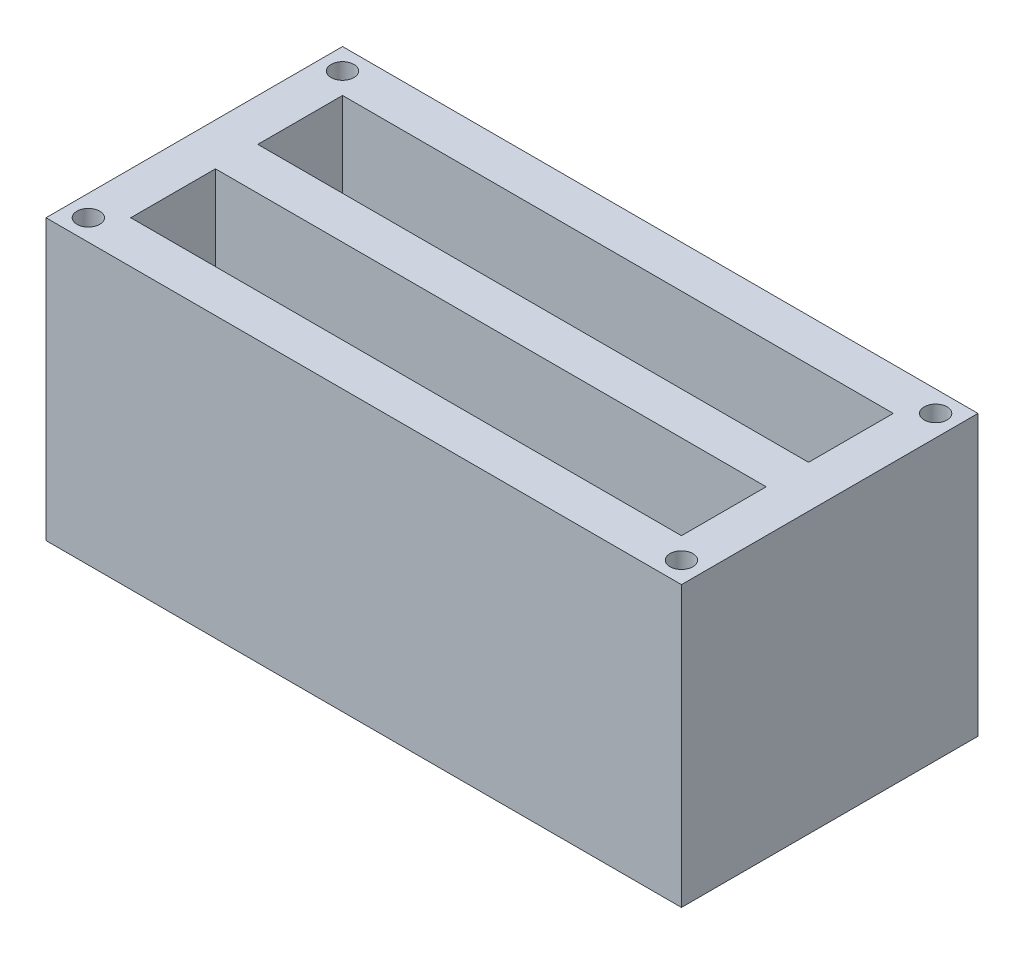
from build123d import *

# Parameters (mm, degrees)
SKETCH1_W           = 75
SKETCH1_H           = 35
BOSS_EXTRUDE1_DEPTH = 3
SKETCH2_W           = 75
SKETCH2_H           = 35
SKETCH2_W_2         = 65
SKETCH2_H_2         = 10
BOSS_EXTRUDE2_DEPTH = 30
CUT_EXTRUDE1_DEPTH  = 90.101066211
SKETCH4_R           = 1.35
CUT_EXTRUDE2_DEPTH  = 15
SKETCH5_R           = 1.35
CUT_EXTRUDE3_DEPTH  = 15


with BuildPart() as part:
    # Sketch1 → Boss-Extrude1 (new body)
    with BuildSketch(Plane(origin=(0, 0, 0), x_dir=(1, 0, 0), z_dir=(0, 1, 0))):
        with Locations((37.5, 17.5)):
            Rectangle(SKETCH1_W, SKETCH1_H)
    extrude(amount=BOSS_EXTRUDE1_DEPTH)

    # Sketch2 → Boss-Extrude2 (add)
    with BuildSketch(Plane(origin=(0, 3, 0), x_dir=(1, 0, 0), z_dir=(0, 1, 0))):
        with Locations((37.5, 17.5)):
            Rectangle(SKETCH2_W, SKETCH2_H)
        with Locations((37.5, 25)):
            Rectangle(SKETCH2_W_2, SKETCH2_H_2, mode=Mode.SUBTRACT)
        with Locations((37.5, 10)):
            Rectangle(SKETCH2_W_2, SKETCH2_H_2, mode=Mode.SUBTRACT)
    extrude(amount=BOSS_EXTRUDE2_DEPTH)

    # Sketch3 → Cut-Extrude1 (cut, through all)
    # profile 1 of 12: a face of its own
    with BuildSketch(Plane.XZ):
        Polygon((7.141025641, -6), (11.038461538, -6), (11.038461538, -7.435897436), (8.576923077, -7.435897436), (8.576923077, -8.974358974), (11.038461538, -8.974358974), (11.038461538, -10.41025641), (8.576923077, -10.41025641), (8.576923077, -14), (7.141025641, -14), align=None)
    # profile 2 of 12: a face of its own
    with BuildSketch(Plane.XZ):
        with BuildLine():
            add(Edge.make_bspline(
                [(16.233974359, -5.794871795), (16.373064163, -5.798473079), (16.647658941, -5.80558283), (17.051488767, -5.864848149), (17.440653473, -5.961412491), (17.814977079, -6.09564391), (18.173522321, -6.271178076), (18.517553909, -6.48303848), (18.845839539, -6.73522386), (19.155015201, -7.021851147), (19.440749275, -7.333545807), (19.688338016, -7.669140523), (19.899472611, -8.019939698), (20.074461529, -8.386883311), (20.207748161, -8.77251262), (20.301280903, -9.174861426), (20.361371056, -9.593815263), (20.368282348, -9.879065723), (20.371794872, -10.024038462)],
                knots=[0, 0, 0, 0, 1.014329547, 2.002516266, 2.970391464, 3.935626869, 4.897733899, 5.877609409, 6.878433252, 7.912639331, 8.949961323, 9.958554974, 10.949718813, 11.932905612, 12.9188844, 13.919928257, 14.942845884, 16, 16, 16, 16], degree=3))
            add(Edge.make_bspline(
                [(20.371794872, -10.024038462), (20.368054186, -10.167377692), (20.360683045, -10.449832246), (20.303734046, -10.864925258), (20.208626201, -11.26296407), (20.077600215, -11.64484965), (19.905784935, -12.008732276), (19.698767694, -12.356935287), (19.4510857, -12.686227277), (19.17177289, -12.996431535), (18.864273725, -13.278008461), (18.538583295, -13.526147641), (18.196205437, -13.736411418), (17.837641282, -13.908703481), (17.462121907, -14.042413006), (17.070574891, -14.136754792), (16.663024462, -14.1940882), (16.385870407, -14.201411194), (16.245192308, -14.205128205)],
                knots=[0, 0, 0, 0, 1.051557043, 2.072126891, 3.067553643, 4.050577992, 5.02905126, 6.015227836, 7.017913613, 8.04756643, 9.074058332, 10.072836633, 11.047628519, 12.017157415, 12.98668631, 13.966869689, 14.968021931, 16, 16, 16, 16], degree=3))
            add(Edge.make_bspline(
                [(16.245192308, -14.205128205), (16.098059884, -14.201793863), (15.808964783, -14.195242335), (15.385872809, -14.132940303), (14.980514139, -14.039091678), (14.596294021, -13.899027639), (14.229299499, -13.723935814), (13.882226992, -13.508299734), (13.555193138, -13.252475754), (13.250073856, -12.963015621), (12.973635048, -12.646282748), (12.729623577, -12.311682554), (12.523794488, -11.961771093), (12.35614025, -11.596384596), (12.223968384, -11.217793854), (12.130736149, -10.823693138), (12.075661644, -10.415027645), (12.067990085, -10.137453873), (12.064102564, -9.996794872)],
                knots=[0, 0, 0, 0, 1.067978421, 2.098431617, 3.099715153, 4.085208694, 5.062210972, 6.048429807, 7.046490867, 8.072918869, 9.098532598, 10.095778865, 11.076610158, 12.041847152, 13.011192615, 13.984257998, 14.978533688, 16, 16, 16, 16], degree=3))
            add(Edge.make_bspline(
                [(12.064102564, -9.996794872), (12.065322692, -9.902166859), (12.067747498, -9.714109042), (12.096956845, -9.435416956), (12.139009906, -9.162164565), (12.201204388, -8.895441331), (12.276754787, -8.633365645), (12.374641001, -8.378376973), (12.486062003, -8.127751334), (12.616246954, -7.884448931), (12.761000031, -7.650708349), (12.918938525, -7.427632184), (13.090459572, -7.217917752), (13.275010645, -7.020186897), (13.473227731, -6.835739318), (13.682503491, -6.661963902), (13.906896654, -6.503476743), (14.141495959, -6.356407268), (14.384978789, -6.223414892), (14.636353947, -6.11021576), (14.89044261, -6.011360885), (15.150639058, -5.933340247), (15.414154824, -5.869793254), (15.683805041, -5.827768536), (15.957153571, -5.798559999), (16.141481779, -5.796104114), (16.233974359, -5.794871795)],
                knots=[0, 0, 0, 0, 1.034744296, 2.056386356, 3.06226378, 4.057406941, 5.050368692, 6.043467995, 7.042652155, 8.049140477, 9.059438543, 10.048523776, 11.036952808, 12.020949711, 13.004946614, 13.997082645, 14.994316842, 16.007702937, 17.024872941, 18.026463647, 19.021641123, 20.005082605, 20.995858141, 21.984425357, 22.988620895, 24, 24, 24, 24], degree=3))
        make_face()
        with BuildLine():
            add(Edge.make_bspline(
                [(16.211538462, -7.230769231), (16.117931042, -7.233280928), (15.933187453, -7.238238013), (15.662202253, -7.276004299), (15.402046891, -7.336321349), (15.154163511, -7.423689859), (14.917477765, -7.534887799), (14.691570083, -7.669526628), (14.479568819, -7.832234407), (14.278647141, -8.014276079), (14.097147466, -8.217112338), (13.936786779, -8.434485886), (13.802590712, -8.666033711), (13.690200665, -8.909604791), (13.605595869, -9.167938016), (13.54533441, -9.439009835), (13.507251417, -9.723287318), (13.502451008, -9.917078908), (13.5, -10.016025641)],
                knots=[0, 0, 0, 0, 1.033739768, 2.040188636, 3.016340934, 3.979330865, 4.937572243, 5.900995986, 6.878200029, 7.884839167, 8.891893314, 9.879764717, 10.863503415, 11.843163062, 12.837761627, 13.859916423, 14.907309254, 16, 16, 16, 16], degree=3))
            add(Edge.make_bspline(
                [(13.5, -10.016025641), (13.503249662, -10.125680878), (13.509618462, -10.340586975), (13.554430113, -10.654086198), (13.631098388, -10.9501551), (13.741805885, -11.227345651), (13.879112227, -11.488735845), (14.049624911, -11.731121974), (14.250582439, -11.955955332), (14.405398491, -12.087222412), (14.483974359, -12.153846154)],
                knots=[0, 0, 0, 0, 1.078454662, 2.113592447, 3.107694534, 4.079536787, 5.043276885, 6.005368276, 6.987637804, 8, 8, 8, 8], degree=3))
            add(Edge.make_bspline(
                [(14.483974359, -12.153846154), (14.548342996, -12.203065215), (14.675630033, -12.300394425), (14.878807856, -12.425141773), (15.088041007, -12.532062695), (15.304908411, -12.618453535), (15.528952056, -12.686407118), (15.760141219, -12.733993894), (15.998148323, -12.763858712), (16.159099881, -12.767428123), (16.240384615, -12.769230769)],
                knots=[0, 0, 0, 0, 1.023928204, 2.024787132, 3.009472467, 3.9914905, 4.972207045, 5.96565515, 6.972602802, 8, 8, 8, 8], degree=3))
            add(Edge.make_bspline(
                [(16.240384615, -12.769230769), (16.332382454, -12.766697776), (16.513391093, -12.761714031), (16.779331758, -12.724412669), (17.034110991, -12.661285298), (17.279310485, -12.574683215), (17.514223194, -12.462089089), (17.737701035, -12.323274186), (17.950135825, -12.159942973), (18.150801532, -11.975510694), (18.334219474, -11.771875401), (18.494245522, -11.553342405), (18.632708353, -11.324726644), (18.742761247, -11.082792407), (18.830708587, -10.829823441), (18.890244769, -10.5646994), (18.928649477, -10.288513227), (18.933451238, -10.100558776), (18.935897436, -10.004807692)],
                knots=[0, 0, 0, 0, 1.026359118, 2.019393844, 2.989460624, 3.950973911, 4.916101784, 5.890408035, 6.881132271, 7.902007068, 8.92769091, 9.933912415, 10.920395702, 11.90457117, 12.894218921, 13.903490204, 14.931958862, 16, 16, 16, 16], degree=3))
            add(Edge.make_bspline(
                [(18.935897436, -10.004807692), (18.933366599, -9.909607203), (18.928385032, -9.72221956), (18.891018018, -9.44674346), (18.828290984, -9.182789864), (18.741428844, -8.929927709), (18.630510492, -8.687909096), (18.493348696, -8.457585105), (18.330424741, -8.239178403), (18.145488312, -8.034177348), (17.944196376, -7.845794511), (17.728089369, -7.682312453), (17.503214209, -7.540251742), (17.264411162, -7.428967117), (17.016565938, -7.340306893), (16.758166173, -7.275016231), (16.488233162, -7.238503323), (16.304592153, -7.233370241), (16.211538462, -7.230769231)],
                knots=[0, 0, 0, 0, 1.055025985, 2.07665775, 3.074803781, 4.057872707, 5.035505728, 6.020516407, 7.023567878, 8.050795229, 9.077271434, 10.074415901, 11.050397877, 12.019801805, 12.988065821, 13.964604439, 14.968634123, 16, 16, 16, 16], degree=3))
        make_face(mode=Mode.SUBTRACT)
    # profile 3 of 12: a face of its own
    with BuildSketch(Plane.XZ):
        Polygon((21.807692308, -6), (23.243589744, -6), (23.243589744, -12.564102564), (25.5, -12.564102564), (25.5, -14), (21.807692308, -14), align=None)
    # profile 4 of 12: a face of its own
    with BuildSketch(Plane.XZ):
        Polygon((26.730769231, -6), (28.166666667, -6), (28.166666667, -12.564102564), (30.423076923, -12.564102564), (30.423076923, -14), (26.730769231, -14), align=None)
    # profile 5 of 12: a face of its own
    with BuildSketch(Plane.XZ):
        with BuildLine():
            add(Edge.make_bspline(
                [(35.413461538, -5.794871795), (35.552551343, -5.798473079), (35.82714612, -5.80558283), (36.230975947, -5.864848149), (36.620140652, -5.961412491), (36.994464258, -6.09564391), (37.353009501, -6.271178076), (37.697041089, -6.48303848), (38.025326718, -6.73522386), (38.334502381, -7.021851147), (38.620236454, -7.333545807), (38.867825195, -7.669140523), (39.078959791, -8.019939698), (39.253948708, -8.386883311), (39.38723534, -8.77251262), (39.480768083, -9.174861426), (39.540858236, -9.593815263), (39.547769528, -9.879065723), (39.551282051, -10.024038462)],
                knots=[0, 0, 0, 0, 1.014329547, 2.002516266, 2.970391464, 3.935626869, 4.897733899, 5.877609409, 6.878433252, 7.912639331, 8.949961323, 9.958554974, 10.949718813, 11.932905612, 12.9188844, 13.919928257, 14.942845884, 16, 16, 16, 16], degree=3))
            add(Edge.make_bspline(
                [(39.551282051, -10.024038462), (39.547541366, -10.167377692), (39.540170225, -10.449832246), (39.483221226, -10.864925258), (39.38811338, -11.26296407), (39.257087394, -11.64484965), (39.085272114, -12.008732276), (38.878254873, -12.356935287), (38.63057288, -12.686227277), (38.351260069, -12.996431535), (38.043760905, -13.278008461), (37.718070475, -13.526147641), (37.375692617, -13.736411418), (37.017128462, -13.908703481), (36.641609087, -14.042413006), (36.25006207, -14.136754792), (35.842511642, -14.1940882), (35.565357586, -14.201411194), (35.424679487, -14.205128205)],
                knots=[0, 0, 0, 0, 1.051557043, 2.072126891, 3.067553643, 4.050577992, 5.02905126, 6.015227836, 7.017913613, 8.04756643, 9.074058332, 10.072836633, 11.047628519, 12.017157415, 12.98668631, 13.966869689, 14.968021931, 16, 16, 16, 16], degree=3))
            add(Edge.make_bspline(
                [(35.424679487, -14.205128205), (35.277547064, -14.201793863), (34.988451963, -14.195242335), (34.565359988, -14.132940303), (34.160001319, -14.039091678), (33.7757812, -13.899027639), (33.408786679, -13.723935814), (33.061714171, -13.508299734), (32.734680317, -13.252475754), (32.429561036, -12.963015621), (32.153122228, -12.646282748), (31.909110756, -12.311682554), (31.703281667, -11.961771093), (31.535627429, -11.596384596), (31.403455563, -11.217793854), (31.310223329, -10.823693138), (31.255148823, -10.415027645), (31.247477264, -10.137453873), (31.243589744, -9.996794872)],
                knots=[0, 0, 0, 0, 1.067978421, 2.098431617, 3.099715153, 4.085208694, 5.062210972, 6.048429807, 7.046490867, 8.072918869, 9.098532598, 10.095778865, 11.076610158, 12.041847152, 13.011192615, 13.984257998, 14.978533688, 16, 16, 16, 16], degree=3))
            add(Edge.make_bspline(
                [(31.243589744, -9.996794872), (31.244809872, -9.902166859), (31.247234678, -9.714109042), (31.276444024, -9.435416956), (31.318497085, -9.162164565), (31.380691567, -8.895441331), (31.456241966, -8.633365645), (31.55412818, -8.378376973), (31.665549183, -8.127751334), (31.795734133, -7.884448931), (31.94048721, -7.650708349), (32.098425705, -7.427632184), (32.269946752, -7.217917752), (32.454497824, -7.020186897), (32.652714911, -6.835739318), (32.86199067, -6.661963902), (33.086383833, -6.503476743), (33.320983138, -6.356407268), (33.564465968, -6.223414892), (33.815841127, -6.11021576), (34.069929789, -6.011360885), (34.330126238, -5.933340247), (34.593642004, -5.869793254), (34.86329222, -5.827768536), (35.136640751, -5.798559999), (35.320968959, -5.796104114), (35.413461538, -5.794871795)],
                knots=[0, 0, 0, 0, 1.034744296, 2.056386356, 3.06226378, 4.057406941, 5.050368692, 6.043467995, 7.042652155, 8.049140477, 9.059438543, 10.048523776, 11.036952808, 12.020949711, 13.004946614, 13.997082645, 14.994316842, 16.007702937, 17.024872941, 18.026463647, 19.021641123, 20.005082605, 20.995858141, 21.984425357, 22.988620895, 24, 24, 24, 24], degree=3))
        make_face()
        with BuildLine():
            add(Edge.make_bspline(
                [(35.391025641, -7.230769231), (35.297418221, -7.233280928), (35.112674632, -7.238238013), (34.841689432, -7.276004299), (34.58153407, -7.336321349), (34.33365069, -7.423689859), (34.096964945, -7.534887799), (33.871057263, -7.669526628), (33.659055998, -7.832234407), (33.45813432, -8.014276079), (33.276634646, -8.217112338), (33.116273958, -8.434485886), (32.982077891, -8.666033711), (32.869687845, -8.909604791), (32.785083049, -9.167938016), (32.724821589, -9.439009835), (32.686738596, -9.723287318), (32.681938188, -9.917078908), (32.679487179, -10.016025641)],
                knots=[0, 0, 0, 0, 1.033739768, 2.040188636, 3.016340934, 3.979330865, 4.937572243, 5.900995986, 6.878200029, 7.884839167, 8.891893314, 9.879764717, 10.863503415, 11.843163062, 12.837761627, 13.859916423, 14.907309254, 16, 16, 16, 16], degree=3))
            add(Edge.make_bspline(
                [(32.679487179, -10.016025641), (32.682736842, -10.125680878), (32.689105642, -10.340586975), (32.733917293, -10.654086198), (32.810585567, -10.9501551), (32.921293065, -11.227345651), (33.058599406, -11.488735845), (33.22911209, -11.731121974), (33.430069619, -11.955955332), (33.584885671, -12.087222412), (33.663461538, -12.153846154)],
                knots=[0, 0, 0, 0, 1.078454662, 2.113592447, 3.107694534, 4.079536787, 5.043276885, 6.005368276, 6.987637804, 8, 8, 8, 8], degree=3))
            add(Edge.make_bspline(
                [(33.663461538, -12.153846154), (33.727830175, -12.203065215), (33.855117212, -12.300394425), (34.058295036, -12.425141773), (34.267528186, -12.532062695), (34.48439559, -12.618453535), (34.708439235, -12.686407118), (34.939628398, -12.733993894), (35.177635503, -12.763858712), (35.338587061, -12.767428123), (35.419871795, -12.769230769)],
                knots=[0, 0, 0, 0, 1.023928204, 2.024787132, 3.009472467, 3.9914905, 4.972207045, 5.96565515, 6.972602802, 8, 8, 8, 8], degree=3))
            add(Edge.make_bspline(
                [(35.419871795, -12.769230769), (35.511869633, -12.766697776), (35.692878273, -12.761714031), (35.958818937, -12.724412669), (36.213598171, -12.661285298), (36.458797665, -12.574683215), (36.693710373, -12.462089089), (36.917188214, -12.323274186), (37.129623005, -12.159942973), (37.330288712, -11.975510694), (37.513706653, -11.771875401), (37.673732701, -11.553342405), (37.812195533, -11.324726644), (37.922248426, -11.082792407), (38.010195767, -10.829823441), (38.069731948, -10.5646994), (38.108136656, -10.288513227), (38.112938417, -10.100558776), (38.115384615, -10.004807692)],
                knots=[0, 0, 0, 0, 1.026359118, 2.019393844, 2.989460624, 3.950973911, 4.916101784, 5.890408035, 6.881132271, 7.902007068, 8.92769091, 9.933912415, 10.920395702, 11.90457117, 12.894218921, 13.903490204, 14.931958862, 16, 16, 16, 16], degree=3))
            add(Edge.make_bspline(
                [(38.115384615, -10.004807692), (38.112853778, -9.909607203), (38.107872212, -9.72221956), (38.070505198, -9.44674346), (38.007778164, -9.182789864), (37.920916024, -8.929927709), (37.809997671, -8.687909096), (37.672835876, -8.457585105), (37.509911921, -8.239178403), (37.324975492, -8.034177348), (37.123683555, -7.845794511), (36.907576549, -7.682312453), (36.682701388, -7.540251742), (36.443898341, -7.428967117), (36.196053117, -7.340306893), (35.937653352, -7.275016231), (35.667720341, -7.238503323), (35.484079332, -7.233370241), (35.391025641, -7.230769231)],
                knots=[0, 0, 0, 0, 1.055025985, 2.07665775, 3.074803781, 4.057872707, 5.035505728, 6.020516407, 7.023567878, 8.050795229, 9.077271434, 10.074415901, 11.050397877, 12.019801805, 12.988065821, 13.964604439, 14.968634123, 16, 16, 16, 16], degree=3))
        make_face(mode=Mode.SUBTRACT)
    # profile 6 of 12: a face of its own
    with BuildSketch(Plane.XZ):
        Polygon((40.217948718, -6), (41.700320513, -6), (42.884615385, -11.107371795), (44.241987179, -6), (45.637820513, -6), (46.987179487, -11.107371795), (48.168269231, -6), (49.653846154, -6), (47.802884615, -14), (46.302884615, -14), (44.935897436, -8.828525641), (43.560897436, -14), (42.072115385, -14), align=None)
    # profile 7 of 12: a face of its own
    with BuildSketch(Plane.XZ):
        Polygon((54.645833333, -6), (56.136217949, -6), (57.961538462, -11.580128205), (59.799679487, -6), (61.275641026, -6), (62.628205128, -14), (61.174679487, -14), (60.320512821, -8.947115385), (58.657051282, -14), (57.256410256, -14), (55.602564103, -8.947115385), (54.75, -14), (53.294871795, -14), align=None)
    # profile 8 of 12: a face of its own
    with BuildSketch(Plane.XZ):
        Polygon((63.961538462, -6), (68.269230769, -6), (68.269230769, -7.435897436), (65.397435897, -7.435897436), (65.397435897, -8.974358974), (68.269230769, -8.974358974), (68.269230769, -10.41025641), (65.397435897, -10.41025641), (65.397435897, -12.564102564), (68.269230769, -12.564102564), (68.269230769, -14), (63.961538462, -14), align=None)
    # profile 9 of 12: a face of its own
    with BuildSketch(Plane.XZ):
        with BuildLine():
            Line((29.602564103, -22.068910256), (28.528846154, -23.051282051))
            add(Edge.make_bspline(
                [(28.528846154, -23.051282051), (28.482852681, -22.986403476), (28.394551627, -22.86184566), (28.251424828, -22.695059807), (28.108944321, -22.552779064), (27.965790109, -22.435597811), (27.820693328, -22.344228013), (27.673905845, -22.279537187), (27.526259839, -22.238412615), (27.427064515, -22.233291616), (27.378205128, -22.230769231)],
                knots=[0, 0, 0, 0, 1.299362458, 2.494594718, 3.587462134, 4.587049575, 5.512617175, 6.380583204, 7.202344345, 8, 8, 8, 8], degree=3))
            add(Edge.make_bspline(
                [(27.378205128, -22.230769231), (27.332630494, -22.23236753), (27.244637848, -22.235453426), (27.119197804, -22.266127), (27.007830347, -22.319065086), (26.910644166, -22.388286086), (26.833658372, -22.471681343), (26.772191185, -22.559141525), (26.737579994, -22.655677786), (26.73302448, -22.721982785), (26.730769231, -22.754807692)],
                knots=[0, 0, 0, 0, 1.185010067, 2.2879431, 3.333075148, 4.379039566, 5.372662701, 6.27520591, 7.14612461, 8, 8, 8, 8], degree=3))
            add(Edge.make_bspline(
                [(26.730769231, -22.754807692), (26.732182481, -22.78810595), (26.735028572, -22.855164012), (26.762517929, -22.953445954), (26.80395224, -23.049478853), (26.843544415, -23.107938648), (26.863782051, -23.137820513)],
                knots=[0, 0, 0, 0, 0.967525499, 1.948461899, 2.951351359, 4, 4, 4, 4], degree=3))
            add(Edge.make_bspline(
                [(26.863782051, -23.137820513), (26.882180252, -23.161047374), (26.924530479, -23.21451254), (27.005283688, -23.29919303), (27.10669276, -23.402934042), (27.232660128, -23.522168226), (27.377956541, -23.661183712), (27.549316675, -23.814515746), (27.741808038, -23.986912844), (27.878626439, -24.10696394), (27.950320513, -24.169871795)],
                knots=[0, 0, 0, 0, 0.473873513, 1.090794244, 1.870441696, 2.795289791, 3.865433203, 5.087734844, 6.473946851, 8, 8, 8, 8], degree=3))
            add(Edge.make_bspline(
                [(27.950320513, -24.169871795), (28.017615714, -24.228112397), (28.145328024, -24.33864096), (28.327037281, -24.495518509), (28.486729454, -24.636657414), (28.626730895, -24.759939483), (28.744919317, -24.866658227), (28.841791585, -24.95732376), (28.918530831, -25.030170991), (28.962152598, -25.074170763), (28.980769231, -25.092948718)],
                knots=[0, 0, 0, 0, 1.543621617, 2.929473131, 4.163658386, 5.240097082, 6.164993805, 6.925417477, 7.541396219, 8, 8, 8, 8], degree=3))
            add(Edge.make_bspline(
                [(28.980769231, -25.092948718), (29.051396852, -25.169382931), (29.187167945, -25.31631633), (29.363622502, -25.54401689), (29.50885031, -25.766299066), (29.621201297, -25.987345456), (29.706053281, -26.210345322), (29.765875053, -26.440767722), (29.801702711, -26.681020426), (29.805680418, -26.844963567), (29.807692308, -26.927884615)],
                knots=[0, 0, 0, 0, 1.206664779, 2.319633467, 3.337109185, 4.282041471, 5.190008762, 6.099243693, 7.03861361, 8, 8, 8, 8], degree=3))
            add(Edge.make_bspline(
                [(29.807692308, -26.927884615), (29.806260296, -27.008681007), (29.803450635, -27.167206535), (29.769037681, -27.399185032), (29.719966827, -27.621198521), (29.644094679, -27.830831183), (29.551622154, -28.031524072), (29.435694489, -28.220151033), (29.299553342, -28.398621047), (29.143514684, -28.563743745), (28.970917399, -28.713581147), (28.785790409, -28.846969942), (28.586323446, -28.957099383), (28.374220727, -29.047783123), (28.149595784, -29.117628951), (27.912716214, -29.169251528), (27.663219694, -29.200234585), (27.492610378, -29.203473496), (27.405448718, -29.205128205)],
                knots=[0, 0, 0, 0, 1.043214005, 2.046824704, 3.02475056, 3.976699089, 4.921714032, 5.875962561, 6.831408892, 7.817874052, 8.806269674, 9.781291748, 10.760897367, 11.74438705, 12.757449933, 13.795994037, 14.874007457, 16, 16, 16, 16], degree=3))
            add(Edge.make_bspline(
                [(27.405448718, -29.205128205), (27.337027557, -29.203914368), (27.20151442, -29.201510275), (27.001788542, -29.181882854), (26.808930629, -29.150206284), (26.623157919, -29.104804298), (26.443633472, -29.047273824), (26.270349916, -28.977002553), (26.104503483, -28.892901307), (25.944839303, -28.796699543), (25.79213354, -28.684996623), (25.644455288, -28.560076277), (25.50327143, -28.420017173), (25.367903887, -28.265150546), (25.239218779, -28.095037852), (25.113003781, -27.912048223), (24.994868266, -27.712785622), (24.921890704, -27.573001295), (24.884615385, -27.501602564)],
                knots=[0, 0, 0, 0, 1.016823716, 2.013894106, 2.979844003, 3.91962641, 4.853723003, 5.779685073, 6.695824784, 7.614987388, 8.547259901, 9.504950863, 10.487499108, 11.500346958, 12.559593716, 13.656357062, 14.802919212, 16, 16, 16, 16], degree=3))
            Line((24.884615385, -27.501602564), (26.147435897, -26.743589744))
            add(Edge.make_bspline(
                [(26.147435897, -26.743589744), (26.19406175, -26.824636632), (26.283447495, -26.980010445), (26.434919996, -27.188774854), (26.590095841, -27.367547013), (26.752562555, -27.513167114), (26.920344605, -27.627582284), (27.094252416, -27.709351302), (27.274408174, -27.759966231), (27.397122091, -27.766147483), (27.458333333, -27.769230769)],
                knots=[0, 0, 0, 0, 1.283663364, 2.460892379, 3.537111102, 4.529833553, 5.449777664, 6.316464042, 7.160231139, 8, 8, 8, 8], degree=3))
            add(Edge.make_bspline(
                [(27.458333333, -27.769230769), (27.52059393, -27.766712791), (27.641388555, -27.761827546), (27.813807424, -27.716704009), (27.971887572, -27.645856747), (28.108530884, -27.544767473), (28.224231826, -27.428095087), (28.309625762, -27.298291723), (28.363270809, -27.157847616), (28.368942391, -27.060285901), (28.371794872, -27.011217949)],
                knots=[0, 0, 0, 0, 1.13588714, 2.203786484, 3.234766741, 4.283437687, 5.291419208, 6.222934724, 7.106237994, 8, 8, 8, 8], degree=3))
            add(Edge.make_bspline(
                [(28.371794872, -27.011217949), (28.369160723, -26.965568204), (28.363809701, -26.872835118), (28.324395721, -26.734955931), (28.26277965, -26.597139448), (28.189883493, -26.48409864), (28.115702526, -26.389452636), (28.044768789, -26.307446155), (27.958390262, -26.21684335), (27.856785962, -26.11753025), (27.741298348, -26.008632576), (27.611830136, -25.890160992), (27.466898778, -25.763159091), (27.364461008, -25.676646651), (27.310897436, -25.631410256)],
                knots=[0, 0, 0, 0, 0.916159276, 1.861089862, 2.860218735, 3.940849679, 4.552606315, 5.27541173, 6.11797699, 7.06649574, 8.129236253, 9.306560635, 10.591630461, 12, 12, 12, 12], degree=3))
            add(Edge.make_bspline(
                [(27.310897436, -25.631410256), (27.209070953, -25.545255287), (27.013635111, -25.379897824), (26.737459471, -25.135670057), (26.488600491, -24.90741683), (26.269207584, -24.692316435), (26.076485346, -24.494341277), (25.911738975, -24.311883326), (25.776778284, -24.143535169), (25.634761259, -23.944138043), (25.49981669, -23.701158944), (25.383186289, -23.40882692), (25.307521407, -23.116531989), (25.299044209, -22.920301271), (25.294871795, -22.823717949)],
                knots=[0, 0, 0, 0, 1.345494975, 2.582412109, 3.71882943, 4.751509156, 5.681369928, 6.505683931, 7.230279997, 7.856715994, 8.973648664, 10.023341002, 11.027102913, 12, 12, 12, 12], degree=3))
            add(Edge.make_bspline(
                [(25.294871795, -22.823717949), (25.296607097, -22.75522624), (25.300025827, -22.620290218), (25.330521433, -22.421886457), (25.376098277, -22.230443499), (25.442288939, -22.046659814), (25.528196426, -21.870765598), (25.632527732, -21.701899777), (25.756902925, -21.541616551), (25.897065371, -21.390022179), (26.051488501, -21.251482174), (26.21650924, -21.129206738), (26.391193555, -21.025931126), (26.574472817, -20.940256507), (26.767482731, -20.874678029), (26.968801402, -20.828192735), (27.178717584, -20.800544765), (27.32149804, -20.796786344), (27.394230769, -20.794871795)],
                knots=[0, 0, 0, 0, 1.010766082, 1.991317756, 2.957454644, 3.913069143, 4.869106762, 5.843196583, 6.838735724, 7.860187025, 8.887984031, 9.89767229, 10.887916223, 11.879572884, 12.879850636, 13.892031539, 14.926195476, 16, 16, 16, 16], degree=3))
            add(Edge.make_bspline(
                [(27.394230769, -20.794871795), (27.488488787, -20.798319954), (27.676260782, -20.805189054), (27.953887092, -20.858903168), (28.225060865, -20.943374271), (28.443577772, -21.045279364), (28.617447597, -21.143994875), (28.750702576, -21.234879682), (28.88629669, -21.338993115), (29.025323421, -21.45666326), (29.165199437, -21.590107178), (29.309902083, -21.736148132), (29.457459607, -21.896048258), (29.553348602, -22.010280166), (29.602564103, -22.068910256)],
                knots=[0, 0, 0, 0, 1.282922637, 2.555718331, 3.837320111, 5.142675274, 5.830281639, 6.55870424, 7.337177975, 8.157850921, 9.037902056, 9.96903443, 10.957596896, 12, 12, 12, 12], degree=3))
        make_face()
    # profile 10 of 12: a face of its own
    with BuildSketch(Plane.XZ):
        Polygon((30.423076923, -21), (34.730769231, -21), (34.730769231, -22.435897436), (33.294871795, -22.435897436), (33.294871795, -29), (31.858974359, -29), (31.858974359, -22.435897436), (30.423076923, -22.435897436), align=None)
    # profile 11 of 12: a face of its own
    with BuildSketch(Plane.XZ):
        with BuildLine():
            add(Edge.make_bspline(
                [(39.618589744, -20.794871795), (39.757679548, -20.798473079), (40.032274325, -20.80558283), (40.436104152, -20.864848149), (40.825268858, -20.961412491), (41.199592463, -21.09564391), (41.558137706, -21.271178076), (41.902169294, -21.48303848), (42.230454923, -21.73522386), (42.539630586, -22.021851147), (42.825364659, -22.333545807), (43.0729534, -22.669140523), (43.284087996, -23.019939698), (43.459076914, -23.386883311), (43.592363545, -23.77251262), (43.685896288, -24.174861426), (43.745986441, -24.593815263), (43.752897733, -24.879065723), (43.756410256, -25.024038462)],
                knots=[0, 0, 0, 0, 1.014329547, 2.002516266, 2.970391464, 3.935626869, 4.897733899, 5.877609409, 6.878433252, 7.912639331, 8.949961323, 9.958554974, 10.949718813, 11.932905612, 12.9188844, 13.919928257, 14.942845884, 16, 16, 16, 16], degree=3))
            add(Edge.make_bspline(
                [(43.756410256, -25.024038462), (43.752669571, -25.167377692), (43.74529843, -25.449832246), (43.688349431, -25.864925258), (43.593241585, -26.26296407), (43.462215599, -26.64484965), (43.290400319, -27.008732276), (43.083383078, -27.356935287), (42.835701085, -27.686227277), (42.556388275, -27.996431535), (42.24888911, -28.278008461), (41.92319868, -28.526147641), (41.580820822, -28.736411418), (41.222256667, -28.908703481), (40.846737292, -29.042413006), (40.455190276, -29.136754792), (40.047639847, -29.1940882), (39.770485791, -29.201411194), (39.629807692, -29.205128205)],
                knots=[0, 0, 0, 0, 1.051557043, 2.072126891, 3.067553643, 4.050577992, 5.02905126, 6.015227836, 7.017913613, 8.04756643, 9.074058332, 10.072836633, 11.047628519, 12.017157415, 12.98668631, 13.966869689, 14.968021931, 16, 16, 16, 16], degree=3))
            add(Edge.make_bspline(
                [(39.629807692, -29.205128205), (39.482675269, -29.201793863), (39.193580168, -29.195242335), (38.770488194, -29.132940303), (38.365129524, -29.039091678), (37.980909405, -28.899027639), (37.613914884, -28.723935814), (37.266842377, -28.508299734), (36.939808522, -28.252475754), (36.634689241, -27.963015621), (36.358250433, -27.646282748), (36.114238961, -27.311682554), (35.908409872, -26.961771093), (35.740755634, -26.596384596), (35.608583768, -26.217793854), (35.515351534, -25.823693138), (35.460277028, -25.415027645), (35.452605469, -25.137453873), (35.448717949, -24.996794872)],
                knots=[0, 0, 0, 0, 1.067978421, 2.098431617, 3.099715153, 4.085208694, 5.062210972, 6.048429807, 7.046490867, 8.072918869, 9.098532598, 10.095778865, 11.076610158, 12.041847152, 13.011192615, 13.984257998, 14.978533688, 16, 16, 16, 16], degree=3))
            add(Edge.make_bspline(
                [(35.448717949, -24.996794872), (35.449938077, -24.902166859), (35.452362883, -24.714109042), (35.481572229, -24.435416956), (35.52362529, -24.162164565), (35.585819772, -23.895441331), (35.661370171, -23.633365645), (35.759256386, -23.378376973), (35.870677388, -23.127751334), (36.000862338, -22.884448931), (36.145615415, -22.650708349), (36.30355391, -22.427632184), (36.475074957, -22.217917752), (36.659626029, -22.020186897), (36.857843116, -21.835739318), (37.067118875, -21.661963902), (37.291512039, -21.503476743), (37.526111344, -21.356407268), (37.769594173, -21.223414892), (38.020969332, -21.11021576), (38.275057994, -21.011360885), (38.535254443, -20.933340247), (38.798770209, -20.869793254), (39.068420425, -20.827768536), (39.341768956, -20.798559999), (39.526097164, -20.796104114), (39.618589744, -20.794871795)],
                knots=[0, 0, 0, 0, 1.034744296, 2.056386356, 3.06226378, 4.057406941, 5.050368692, 6.043467995, 7.042652155, 8.049140477, 9.059438543, 10.048523776, 11.036952808, 12.020949711, 13.004946614, 13.997082645, 14.994316842, 16.007702937, 17.024872941, 18.026463647, 19.021641123, 20.005082605, 20.995858141, 21.984425357, 22.988620895, 24, 24, 24, 24], degree=3))
        make_face()
        with BuildLine():
            add(Edge.make_bspline(
                [(39.596153846, -22.230769231), (39.502546426, -22.233280928), (39.317802837, -22.238238013), (39.046817637, -22.276004299), (38.786662275, -22.336321349), (38.538778896, -22.423689859), (38.30209315, -22.534887799), (38.076185468, -22.669526628), (37.864184203, -22.832234407), (37.663262525, -23.014276079), (37.481762851, -23.217112338), (37.321402163, -23.434485886), (37.187206096, -23.666033711), (37.07481605, -23.909604791), (36.990211254, -24.167938016), (36.929949794, -24.439009835), (36.891866801, -24.723287318), (36.887066393, -24.917078908), (36.884615385, -25.016025641)],
                knots=[0, 0, 0, 0, 1.033739768, 2.040188636, 3.016340934, 3.979330865, 4.937572243, 5.900995986, 6.878200029, 7.884839167, 8.891893314, 9.879764717, 10.863503415, 11.843163062, 12.837761627, 13.859916423, 14.907309254, 16, 16, 16, 16], degree=3))
            add(Edge.make_bspline(
                [(36.884615385, -25.016025641), (36.887865047, -25.125680878), (36.894233847, -25.340586975), (36.939045498, -25.654086198), (37.015713772, -25.9501551), (37.12642127, -26.227345651), (37.263727611, -26.488735845), (37.434240296, -26.731121974), (37.635197824, -26.955955332), (37.790013876, -27.087222412), (37.868589744, -27.153846154)],
                knots=[0, 0, 0, 0, 1.078454662, 2.113592447, 3.107694534, 4.079536787, 5.043276885, 6.005368276, 6.987637804, 8, 8, 8, 8], degree=3))
            add(Edge.make_bspline(
                [(37.868589744, -27.153846154), (37.93295838, -27.203065215), (38.060245417, -27.300394425), (38.263423241, -27.425141773), (38.472656391, -27.532062695), (38.689523796, -27.618453535), (38.913567441, -27.686407118), (39.144756603, -27.733993894), (39.382763708, -27.763858712), (39.543715266, -27.767428123), (39.625, -27.769230769)],
                knots=[0, 0, 0, 0, 1.023928204, 2.024787132, 3.009472467, 3.9914905, 4.972207045, 5.96565515, 6.972602802, 8, 8, 8, 8], degree=3))
            add(Edge.make_bspline(
                [(39.625, -27.769230769), (39.716997838, -27.766697776), (39.898006478, -27.761714031), (40.163947142, -27.724412669), (40.418726376, -27.661285298), (40.66392587, -27.574683215), (40.898838579, -27.462089089), (41.122316419, -27.323274186), (41.33475121, -27.159942973), (41.535416917, -26.975510694), (41.718834858, -26.771875401), (41.878860907, -26.553342405), (42.017323738, -26.324726644), (42.127376632, -26.082792407), (42.215323972, -25.829823441), (42.274860153, -25.5646994), (42.313264861, -25.288513227), (42.318066622, -25.100558776), (42.320512821, -25.004807692)],
                knots=[0, 0, 0, 0, 1.026359118, 2.019393844, 2.989460624, 3.950973911, 4.916101784, 5.890408035, 6.881132271, 7.902007068, 8.92769091, 9.933912415, 10.920395702, 11.90457117, 12.894218921, 13.903490204, 14.931958862, 16, 16, 16, 16], degree=3))
            add(Edge.make_bspline(
                [(42.320512821, -25.004807692), (42.317981984, -24.909607203), (42.313000417, -24.72221956), (42.275633403, -24.44674346), (42.212906369, -24.182789864), (42.126044229, -23.929927709), (42.015125876, -23.687909096), (41.877964081, -23.457585105), (41.715040126, -23.239178403), (41.530103697, -23.034177348), (41.328811761, -22.845794511), (41.112704754, -22.682312453), (40.887829593, -22.540251742), (40.649026546, -22.428967117), (40.401181322, -22.340306893), (40.142781557, -22.275016231), (39.872848546, -22.238503323), (39.689207537, -22.233370241), (39.596153846, -22.230769231)],
                knots=[0, 0, 0, 0, 1.055025985, 2.07665775, 3.074803781, 4.057872707, 5.035505728, 6.020516407, 7.023567878, 8.050795229, 9.077271434, 10.074415901, 11.050397877, 12.019801805, 12.988065821, 13.964604439, 14.968634123, 16, 16, 16, 16], degree=3))
        make_face(mode=Mode.SUBTRACT)
    # profile 12 of 12: a face of its own
    with BuildSketch(Plane.XZ):
        with BuildLine():
            Line((45.192307692, -21), (46.794871795, -21))
            add(Edge.make_bspline(
                [(46.794871795, -21), (46.899581254, -21.000468702), (47.10158775, -21.001372926), (47.392897737, -21.012337846), (47.661645463, -21.031987649), (47.907769184, -21.0562717), (48.1311677, -21.090316993), (48.332120773, -21.129347256), (48.510670106, -21.176897476), (48.668829107, -21.233338929), (48.810771702, -21.299881196), (48.945095177, -21.37075346), (49.068763808, -21.455337008), (49.188019524, -21.544515784), (49.296044269, -21.646809002), (49.399577274, -21.7554089), (49.494233633, -21.874622461), (49.58045195, -22.003006636), (49.658665249, -22.138189435), (49.726997619, -22.280412526), (49.782425011, -22.42990096), (49.828921701, -22.585687718), (49.866268295, -22.74776601), (49.891127377, -22.917132632), (49.908012916, -23.092605002), (49.909502832, -23.212031608), (49.91025641, -23.272435897)],
                knots=[0, 0, 0, 0, 1.698747864, 3.27724071, 4.728299578, 6.070144658, 7.288476769, 8.393259625, 9.389771311, 10.283485332, 11.113357557, 11.931608583, 12.74405601, 13.541433047, 14.344816069, 15.154114104, 15.974336324, 16.810834471, 17.661136416, 18.50621059, 19.367396281, 20.244825668, 21.142564693, 22.063065223, 23.020325768, 24, 24, 24, 24], degree=3))
            add(Edge.make_bspline(
                [(49.91025641, -23.272435897), (49.909166077, -23.339259724), (49.907023438, -23.470576756), (49.886018669, -23.663071413), (49.850135888, -23.846597641), (49.803238969, -24.022703149), (49.737844552, -24.18849061), (49.663134501, -24.347915765), (49.57121744, -24.496508821), (49.466187505, -24.636128499), (49.351482833, -24.767909972), (49.22438034, -24.888048301), (49.087302656, -24.997362462), (48.941043273, -25.096998079), (48.785053089, -25.186754162), (48.61944466, -25.267471184), (48.443087118, -25.336567562), (48.320277031, -25.372704408), (48.258012821, -25.391025641)],
                knots=[0, 0, 0, 0, 1.102006807, 2.165578795, 3.188629044, 4.184801286, 5.166646146, 6.124351954, 7.085497154, 8.042432466, 9.003981491, 9.963833307, 10.922997304, 11.89326795, 12.880200226, 13.889073926, 14.929769137, 16, 16, 16, 16], degree=3))
            add(Edge.make_bspline(
                [(48.258012821, -25.391025641), (48.21700203, -25.401229192), (48.128159451, -25.42333337), (47.981149385, -25.445774658), (47.811735719, -25.466408042), (47.619370629, -25.484139938), (47.40394321, -25.496193496), (47.165662053, -25.505606788), (46.904419174, -25.512451224), (46.722761206, -25.512694095), (46.628205128, -25.512820513)],
                knots=[0, 0, 0, 0, 0.618981996, 1.340914327, 2.176866532, 3.120127938, 4.170906482, 5.338178032, 6.614476169, 8, 8, 8, 8], degree=3))
            Line((46.628205128, -25.512820513), (46.628205128, -29))
            Line((46.628205128, -29), (45.192307692, -29))
            Line((45.192307692, -29), (45.192307692, -21))
        make_face()
        with BuildLine():
            Line((46.628205128, -24.076923077), (47.136217949, -24.076923077))
            add(Edge.make_bspline(
                [(47.136217949, -24.076923077), (47.228658902, -24.07633693), (47.398751629, -24.07525841), (47.631038228, -24.059662385), (47.817708208, -24.035844105), (47.965180959, -24.001683183), (48.081624663, -23.94983946), (48.182050068, -23.889866036), (48.268187502, -23.814031287), (48.342769841, -23.727377111), (48.402396174, -23.62780712), (48.44374393, -23.516942617), (48.47060262, -23.397112984), (48.473083269, -23.313719492), (48.474358974, -23.270833333)],
                knots=[0, 0, 0, 0, 1.8619151, 3.425951444, 4.686033666, 5.651700536, 6.461346321, 7.243864085, 7.999046032, 8.762387399, 9.539336099, 10.322741239, 11.137448474, 12, 12, 12, 12], degree=3))
            add(Edge.make_bspline(
                [(48.474358974, -23.270833333), (48.473096391, -23.233364255), (48.470646677, -23.160665236), (48.452650407, -23.055742518), (48.42396953, -22.9579329), (48.382412041, -22.868257874), (48.328688049, -22.786869813), (48.26318763, -22.713800778), (48.186751284, -22.647485934), (48.127737955, -22.612384474), (48.09775641, -22.594551282)],
                knots=[0, 0, 0, 0, 1.102301479, 2.1387299, 3.123554645, 4.094223062, 5.036071848, 5.982632524, 6.975082478, 8, 8, 8, 8], degree=3))
            add(Edge.make_bspline(
                [(48.09775641, -22.594551282), (48.072360311, -22.581707746), (48.018591564, -22.554515349), (47.927018176, -22.5229022), (47.821343884, -22.496233025), (47.700855268, -22.474097868), (47.566032991, -22.456918687), (47.416901109, -22.443780912), (47.25324016, -22.4384977), (47.139423762, -22.436788097), (47.080128205, -22.435897436)],
                knots=[0, 0, 0, 0, 0.656809284, 1.390599849, 2.23162475, 3.173112763, 4.218524733, 5.370385145, 6.63003504, 8, 8, 8, 8], degree=3))
            Line((47.080128205, -22.435897436), (46.628205128, -22.435897436))
            Line((46.628205128, -22.435897436), (46.628205128, -24.076923077))
        make_face(mode=Mode.SUBTRACT)
    extrude(amount=-CUT_EXTRUDE1_DEPTH, mode=Mode.SUBTRACT)


with BuildPart() as cut_extrude1_piece_1:
    # of the separate pieces the step leaves, piece 1, a body of its own (cut_extrude1_pieces)
    add(part.part.solids().sort_by_distance((0, 33, 0))[0])

    # Sketch4 → Cut-Extrude2 (cut)
    with BuildSketch(Plane(origin=(0, 33, 0), x_dir=(1, 0, 0), z_dir=(0, 1, 0))):
        with Locations(Location((2.5, 32.5, 0), (0, 0, 270))):
            Circle(SKETCH4_R)
        with Locations(Location((2.5, 2.5, 0), (0, 0, 270))):
            Circle(SKETCH4_R)
        with Locations(Location((72.5, 2.5, 0), (0, 0, 270))):
            Circle(SKETCH4_R)
        with Locations(Location((72.5, 32.5, 0), (0, 0, 270))):
            Circle(SKETCH4_R)
    extrude(amount=-CUT_EXTRUDE2_DEPTH, mode=Mode.SUBTRACT)

    # Sketch5 → Cut-Extrude3 (cut)
    with BuildSketch(Plane(origin=(0, 0, -35), x_dir=(-1, 0, 0), z_dir=(0, 0, -1))):
        with Locations((-55, 18)):
            Circle(SKETCH5_R)
        with Locations((-20, 18)):
            Circle(SKETCH5_R)
    extrude(amount=-CUT_EXTRUDE3_DEPTH, mode=Mode.SUBTRACT)


with BuildPart() as cut_extrude1_piece_2:
    # of the separate pieces the step leaves, piece 2, a body of its own (cut_extrude1_pieces)
    add(part.part.solids().sort_by_distance((35.391025641, 0, -7.230769231))[0])


with BuildPart() as cut_extrude1_piece_3:
    # of the separate pieces the step leaves, piece 3, a body of its own (cut_extrude1_pieces)
    add(part.part.solids().sort_by_distance((39.596153846, 0, -22.230769231))[0])


with BuildPart() as cut_extrude1_piece_4:
    # of the separate pieces the step leaves, piece 4, a body of its own (cut_extrude1_pieces)
    add(part.part.solids().sort_by_distance((16.211538462, 0, -7.230769231))[0])


with BuildPart() as cut_extrude1_piece_5:
    # of the separate pieces the step leaves, piece 5, a body of its own (cut_extrude1_pieces)
    add(part.part.solids().sort_by_distance((46.628205128, 0, -24.076923077))[0])


solid = Compound([cut_extrude1_piece_1.part, cut_extrude1_piece_2.part, cut_extrude1_piece_3.part, cut_extrude1_piece_4.part, cut_extrude1_piece_5.part])
